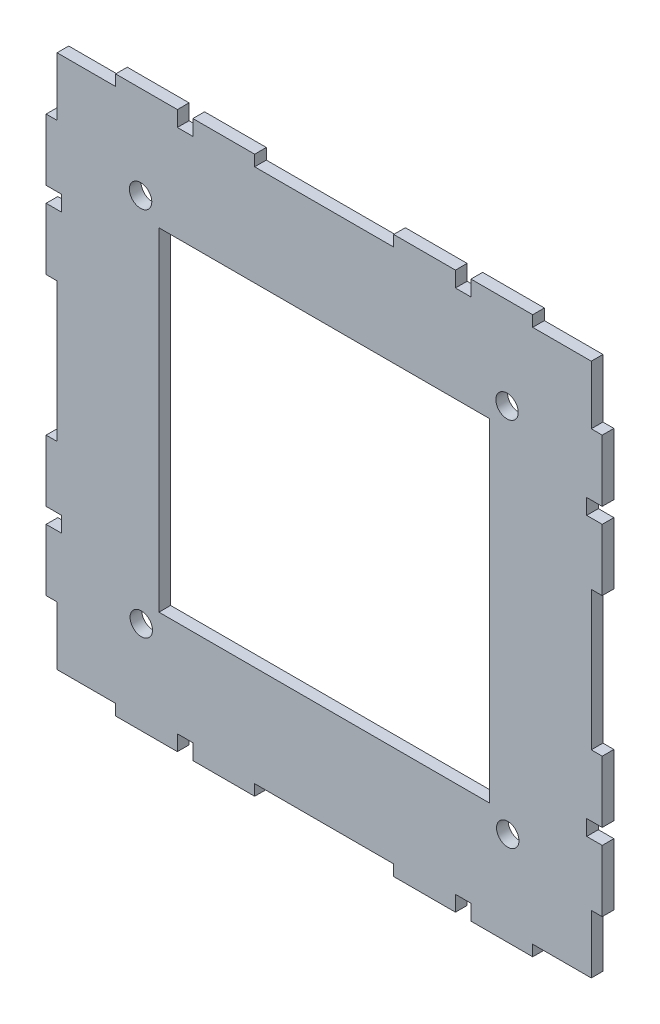
from build123d import *

# Parameters (mm, degrees)
SKETCH1_R           = 3.05
SKETCH1_W           = 89.973098965
SKETCH1_H           = 90.646237782
BOSS_EXTRUDE1_DEPTH = 3.175


with BuildPart() as part:
    # Sketch1 → Boss-Extrude1 (new body)
    with BuildSketch(Plane.XY):
        Polygon((311.775650515, 305.698342824), (311.775650515, 289.751882688), (308.79500376, 289.751882688), (308.79500376, 272.936067248), (313.017586662, 272.936067248), (313.017586662, 270.824775797), (313.017586662, 268.713484346), (308.79500376, 268.713484346), (308.79500376, 251.897668907), (311.775650515, 251.897668907), (311.775650515, 214.043455125), (308.79500376, 214.043455125), (308.79500376, 197.227639686), (313.017586662, 197.227639686), (313.017586662, 195.116348235), (313.017586662, 193.005056783), (308.79500376, 193.005056783), (308.79500376, 176.189241344), (311.775650515, 176.189241344), (311.775650515, 160.242781208), (327.722110651, 160.242781208), (327.722110651, 157.262134453), (344.53792609, 157.262134453), (344.53792609, 161.484717355), (346.649217542, 161.484717355), (348.760508993, 161.484717355), (348.760508993, 157.262134453), (365.576324432, 157.262134453), (365.576324432, 160.242781208), (403.430538214, 160.242781208), (403.430538214, 157.262134453), (420.246353653, 157.262134453), (420.246353653, 161.484717355), (422.357645104, 161.484717355), (424.468936555, 161.484717355), (424.468936555, 157.262134453), (441.284751995, 157.262134453), (441.284751995, 160.242781208), (457.231212131, 160.242781208), (457.231212131, 176.189241344), (460.211858886, 176.189241344), (460.211858886, 193.005056783), (455.989275984, 193.005056783), (455.989275984, 195.116348235), (455.989275984, 197.227639686), (460.211858886, 197.227639686), (460.211858886, 214.043455125), (457.231212131, 214.043455125), (457.231212131, 251.897668907), (460.211858886, 251.897668907), (460.211858886, 268.713484346), (455.989275984, 268.713484346), (455.989275984, 270.824775797), (455.989275984, 272.936067248), (460.211858886, 272.936067248), (460.211858886, 289.751882688), (457.231212131, 289.751882688), (457.231212131, 305.698342824), (441.284751995, 305.698342824), (441.284751995, 308.678989579), (424.468936555, 308.678989579), (424.468936555, 304.456406677), (422.357645104, 304.456406677), (420.246353653, 304.456406677), (420.246353653, 308.678989579), (403.430538214, 308.678989579), (403.430538214, 305.698342824), (365.576324432, 305.698342824), (365.576324432, 308.678989579), (348.760508993, 308.678989579), (348.760508993, 304.456406677), (346.649217542, 304.456406677), (344.53792609, 304.456406677), (344.53792609, 308.678989579), (327.722110651, 308.678989579), (327.722110651, 305.698342824), align=None)
        with Locations((334.51688184, 283.411573885)):
            Circle(SKETCH1_R, mode=Mode.SUBTRACT)
        with Locations(Location((434.302437265, 283.655336103, 0), (0, 0, 180))):
            Circle(SKETCH1_R, mode=Mode.SUBTRACT)
        with Locations((434.489980805, 182.765336103)):
            Circle(SKETCH1_R, mode=Mode.SUBTRACT)
        with Locations(Location((334.704655446, 182.517816292, 0), (0, 0, 180))):
            Circle(SKETCH1_R, mode=Mode.SUBTRACT)
        with Locations((384.503431322, 232.970562016)):
            Rectangle(SKETCH1_W, SKETCH1_H, mode=Mode.SUBTRACT)
    extrude(amount=BOSS_EXTRUDE1_DEPTH)


solid = part.part
